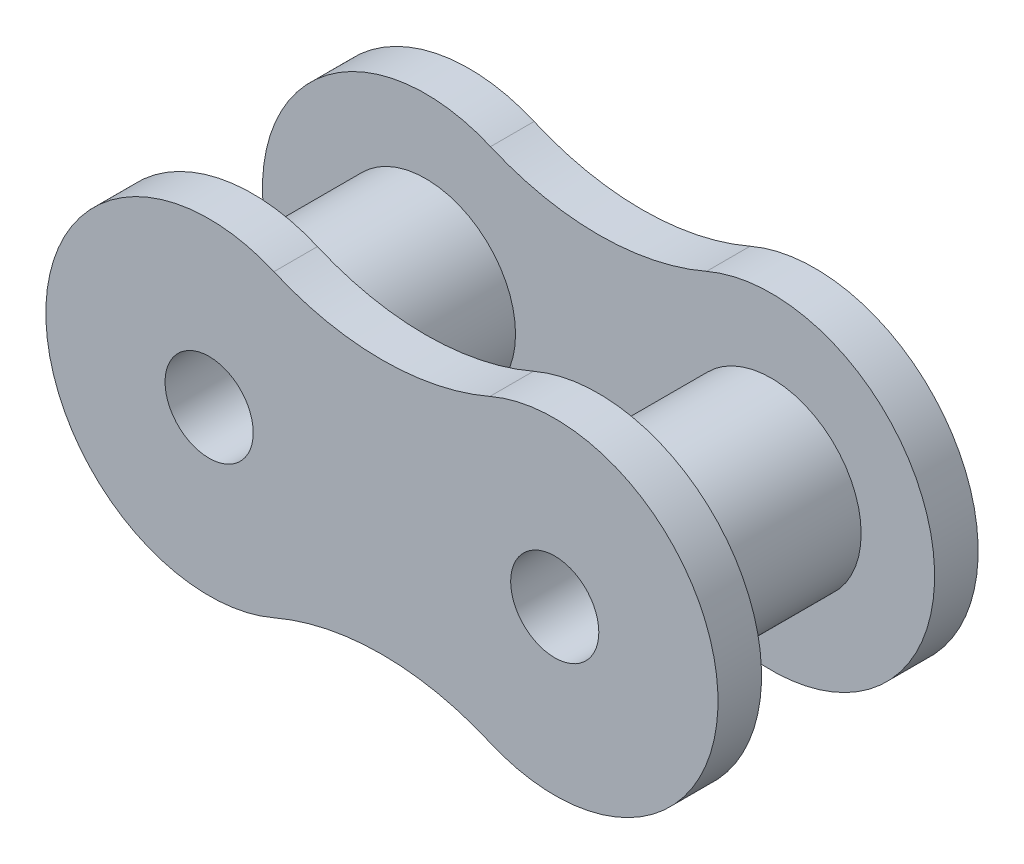
from build123d import *

# Parameters (mm, degrees)
EXTRUDE_1_DEPTH     = 0.8
SKETCH_2_R          = 1.65
EXTRUDE_2_DEPTH     = 3.18
EXTRUDE_START       = 0.8
EXTRUDE_3_DEPTH     = 0.8
SKETCH_5_R          = 0.81
CUT_EXTRUDE_1_DEPTH = 4.8


with BuildPart() as part:
    # 草图1 → 凸台-拉伸1 (new body)
    with BuildSketch(Plane.XY):
        with BuildLine():
            ThreePointArc((1.190625, 2.753618004), (-3, 0), (1.190625, -2.753618004))
            ThreePointArc((1.190625, -2.753618004), (3.175, -2.342981343), (5.159375, -2.753618004))
            ThreePointArc((5.159375, -2.753618004), (9.35, 0), (5.159375, 2.753618004))
            ThreePointArc((5.159375, 2.753618004), (3.175, 2.342981343), (1.190625, 2.753618004))
        make_face()
    extrude(amount=EXTRUDE_1_DEPTH)

    # 草图2 → 凸台-拉伸2 (add)
    with BuildSketch(Plane(origin=(0, 0, 0), x_dir=(-1, 0, 0), z_dir=(0, 0, -1))):
        with Locations(Location((-6.35, 0, 0), (0, 0, 180))):
            Circle(SKETCH_2_R)
        with Locations(Location((0, 0, 0), (0, 0, 180))):
            Circle(SKETCH_2_R)
    extrude(amount=EXTRUDE_2_DEPTH)

    # 草图3 → 凸台-拉伸3 (add)
    with BuildSketch(Plane(origin=(0, 0, -3.18), x_dir=(-1, 0, 0), z_dir=(0, 0, -1)).offset(EXTRUDE_START)):
        with BuildLine():
            ThreePointArc((-1.190625, -2.753618004), (-3.175, -2.342981343), (-5.159375, -2.753618004))
            ThreePointArc((-5.159375, -2.753618004), (-9.35, 0), (-5.159375, 2.753618004))
            ThreePointArc((-5.159375, 2.753618004), (-3.175, 2.342981343), (-1.190625, 2.753618004))
            ThreePointArc((-1.190625, 2.753618004), (3, 0), (-1.190625, -2.753618004))
        make_face()
    extrude(amount=-EXTRUDE_3_DEPTH)

    # 草图5 → 切除-拉伸1 (cut)
    with BuildSketch(Plane(origin=(0, 0, -3.98), x_dir=(-1, 0, 0), z_dir=(0, 0, -1))):
        with Locations((-6.35, 0)):
            Circle(SKETCH_5_R)
        Circle(SKETCH_5_R)
    extrude(amount=-CUT_EXTRUDE_1_DEPTH, mode=Mode.SUBTRACT)


solid = part.part
